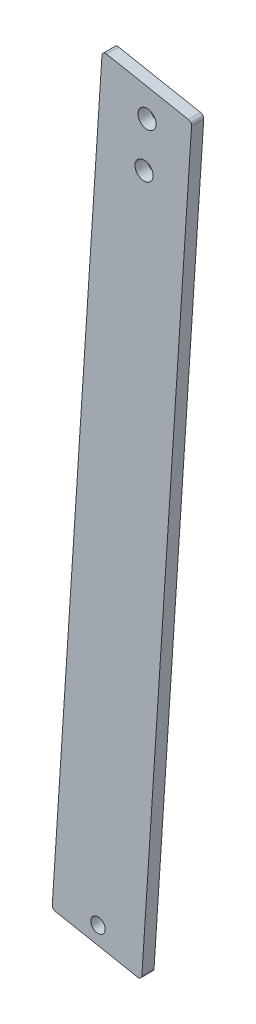
from build123d import *

# Parameters (mm, degrees)
CROQUIS3_R              = 1.2
CROQUIS3_R_2            = 0.95
SALIENTE_EXTRUIR4_DEPTH = 1.6
REDONDEO4_R             = 0.5
REDONDEO5_R             = 0.5


with BuildPart() as part:
    # Croquis3 → Saliente-Extruir4 (new body)
    with BuildSketch(Plane.XY):
        Polygon((4.131159953, -85.774171861), (10.73555349, 15.325828139), (-1.049372117, 17.587581538), (-7.653765654, -83.512418462), align=None)
        with Locations((4.843090686, 12.756704839)):
            Circle(CROQUIS3_R, mode=Mode.SUBTRACT)
        with Locations((4.450627883, 6.677578183)):
            Circle(CROQUIS3_R, mode=Mode.SUBTRACT)
        with Locations((-1.611374093, -82.348187023)):
            Circle(CROQUIS3_R_2, mode=Mode.SUBTRACT)
    extrude(amount=SALIENTE_EXTRUIR4_DEPTH)

    # Redondeo4
    redondeo4_edges = [part.edges().sort_by_distance(p)[0] for p in [
        (10.73555349, 15.325828139, 0.8),
    ]]
    fillet(redondeo4_edges, radius=REDONDEO4_R)

    # Redondeo5
    redondeo5_edges = [part.edges().sort_by_distance(p)[0] for p in [
        (4.131159953, -85.774171861, 0.8),
        (-7.653765654, -83.512418462, 0.8),
        (-1.049372117, 17.587581538, 0.8),
    ]]
    fillet(redondeo5_edges, radius=REDONDEO5_R)


solid = part.part
